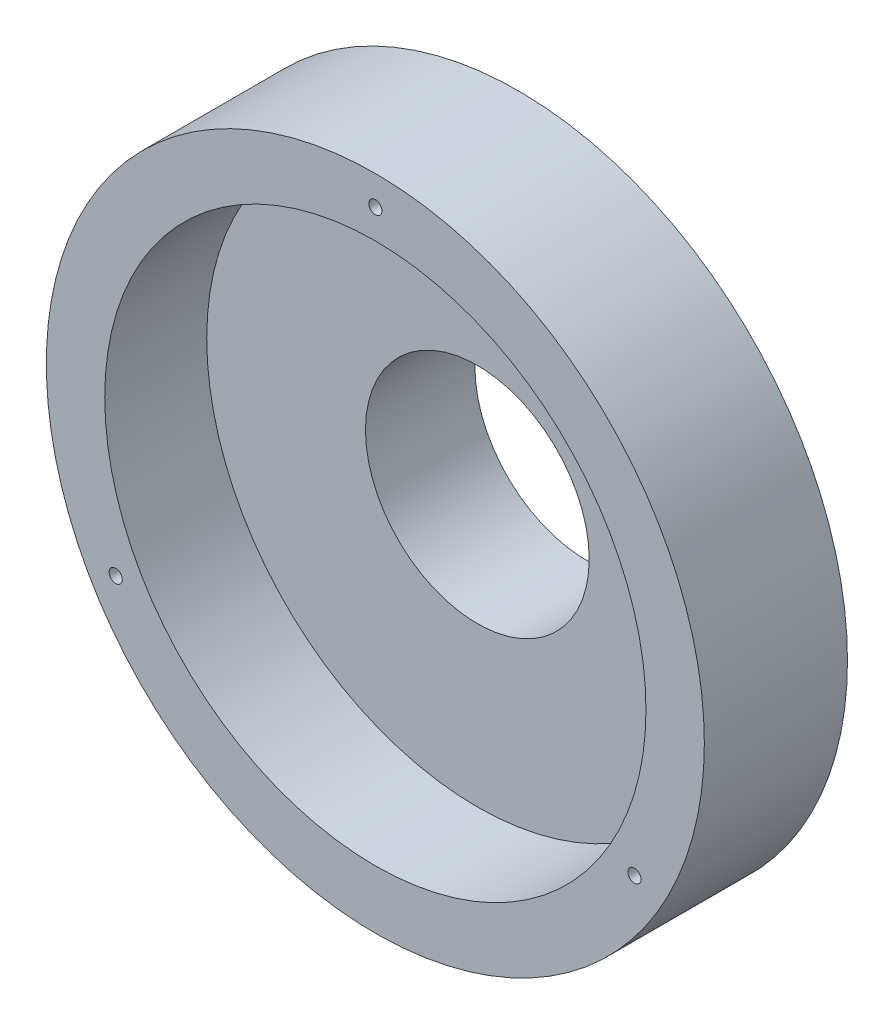
from build123d import *

# Parameters (mm, degrees)
SKETCH1_R                 = 24
BOSS_EXTRUDE1_DEPTH       = 3.8
SKETCH2_R                 = 18.7
BOSS_EXTRUDE2_DEPTH       = 4.5
SKETCH3_R                 = 1
CUT_EXTRUDE1_DEPTH        = 4.5
SKETCH4_R                 = 13.6
CUT_EXTRUDE2_DEPTH        = 35.941236383
SKETCH5_R                 = 40
BOSS_EXTRUDE3_DEPTH       = 17.4
SKETCH6_R                 = 32.9
CUT_EXTRUDE6_DEPTH        = 12.4
CUT_EXTRUDE7_START        = -12.4
SKETCH7_R                 = 13.6
CUT_EXTRUDE7_DEPTH        = 12.4
M2X0_4_TAPPED_HOLE1_D     = 1.6
M2X0_4_TAPPED_HOLE1_DEPTH = 5
M2X0_4_TAPPED_HOLE1_TIP   = 0.480688495


with BuildPart() as part:
    # Sketch1 → Boss-Extrude1 (new body)
    with BuildSketch(Plane.XY):
        with Locations(Location((0, 0, 0), (0, 0, 180))):
            Circle(SKETCH1_R)
    extrude(amount=BOSS_EXTRUDE1_DEPTH)

    # Sketch2 → Boss-Extrude2 (add)
    with BuildSketch(Plane.XY.offset(3.8)):
        Circle(SKETCH2_R)
    extrude(amount=BOSS_EXTRUDE2_DEPTH)

    # Sketch3 → Cut-Extrude1 (cut)
    with BuildSketch(Plane.XY.offset(3.8)):
        with Locations((0, 22.2)):
            Circle(SKETCH3_R)
    extrude(amount=-CUT_EXTRUDE1_DEPTH, mode=Mode.SUBTRACT)

    # Sketch4 → Cut-Extrude2 (cut, through all)
    with BuildSketch(Plane.XY.offset(8.3)):
        Circle(SKETCH4_R)
    extrude(amount=-CUT_EXTRUDE2_DEPTH, mode=Mode.SUBTRACT)

    # Sketch5 → Boss-Extrude3 (add)
    with BuildSketch(Plane.XY.offset(8.3)):
        Circle(SKETCH5_R)
    extrude(amount=BOSS_EXTRUDE3_DEPTH)

    # Sketch6 → Cut-Extrude6 (cut)
    with BuildSketch(Plane.XY.offset(25.7)):
        Circle(SKETCH6_R)
    extrude(amount=-CUT_EXTRUDE6_DEPTH, mode=Mode.SUBTRACT)

    # Sketch7 → Cut-Extrude7 (cut)
    with BuildSketch(Plane(origin=(0, 0, 8.3), x_dir=(-1, 0, 0), z_dir=(0, 0, -1)).offset(CUT_EXTRUDE7_START)):
        with Locations(Location((0, 0, 0), (0, 0, 180))):
            Circle(SKETCH7_R)
    extrude(amount=CUT_EXTRUDE7_DEPTH, mode=Mode.SUBTRACT)

    # M2x0.4 Tapped Hole1
    with Locations(Plane(origin=(0, 36.45, 25.7), x_dir=(1, 0, 0), z_dir=(0, 0, 1))):
        with Locations((0, 0), (-31.566625968, -54.6), (31.501674063, -54.6375)):
            Hole(M2X0_4_TAPPED_HOLE1_D / 2, depth=M2X0_4_TAPPED_HOLE1_DEPTH)
            with Locations((0, 0, -(M2X0_4_TAPPED_HOLE1_DEPTH + M2X0_4_TAPPED_HOLE1_TIP / 2))):  # 118° drill point
                Cone(0, M2X0_4_TAPPED_HOLE1_D / 2, M2X0_4_TAPPED_HOLE1_TIP, mode=Mode.SUBTRACT)


solid = part.part
